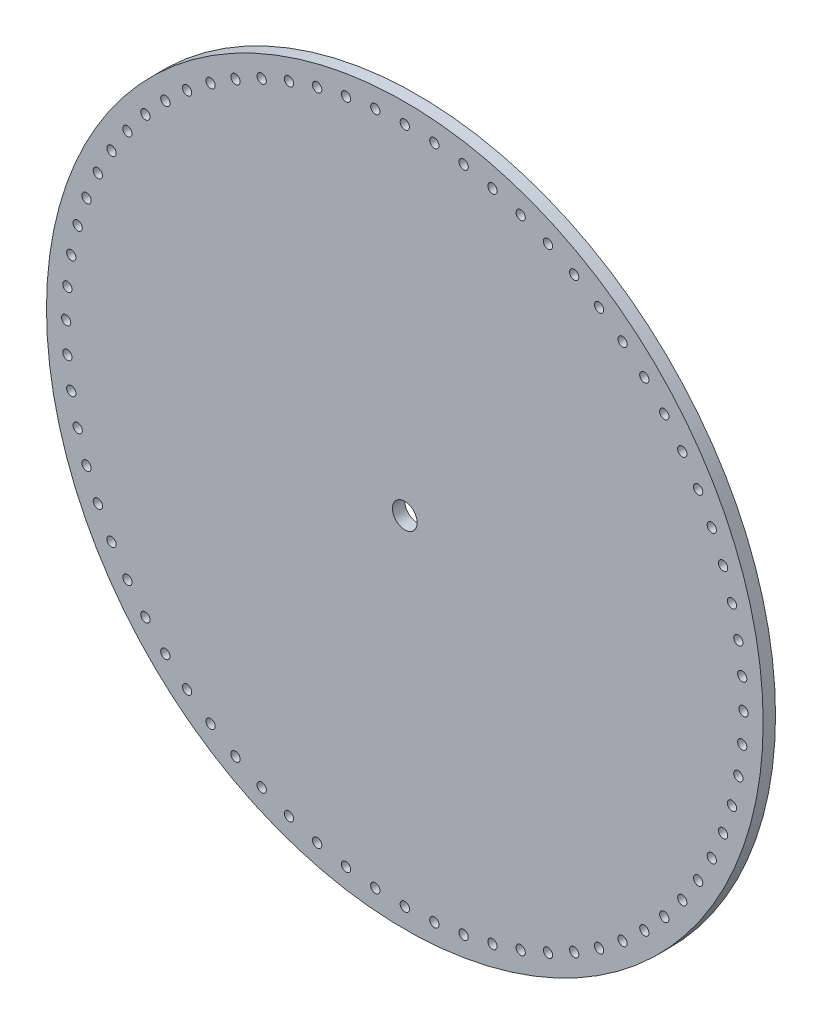
from build123d import *

# Parameters (mm, degrees)
SKETCH2_R           = 184.15
BOSS_EXTRUDE1_DEPTH = 6.35
SKETCH9_R           = 2.38125
CUT_EXTRUDE4_DEPTH  = 261.504832009
CIRPATTERN1_COUNT   = 72
SKETCH10_R          = 6.35
CUT_EXTRUDE7_DEPTH  = 261.504832009


with BuildPart() as part:
    # Sketch2 → Boss-Extrude1 (new body)
    with BuildSketch(Plane.XY):
        Circle(SKETCH2_R)
    extrude(amount=BOSS_EXTRUDE1_DEPTH)

    # Sketch9 → Cut-Extrude4 (cut, through all)
    with BuildSketch(Plane.XY.offset(6.35)):
        with Locations((-174.049180881, 0)):
            Circle(SKETCH9_R)
    cut_extrude4 = extrude(amount=-CUT_EXTRUDE4_DEPTH, mode=Mode.SUBTRACT)

    # CirPattern1: Cut-Extrude4 ×72 about axis
    cirpattern1_axis = Axis((0, 0, 0), (0, 0, 1))
    for i in range(1, CIRPATTERN1_COUNT):
        add(cut_extrude4.rotate(cirpattern1_axis, i * 360 / CIRPATTERN1_COUNT), mode=Mode.SUBTRACT)

    # Sketch10 → Cut-Extrude7 (cut, through all)
    with BuildSketch(Plane(origin=(0, 0, 0), x_dir=(-1, 0, 0), z_dir=(0, 0, -1))):
        Circle(SKETCH10_R)
    extrude(amount=-CUT_EXTRUDE7_DEPTH, mode=Mode.SUBTRACT)


solid = part.part
